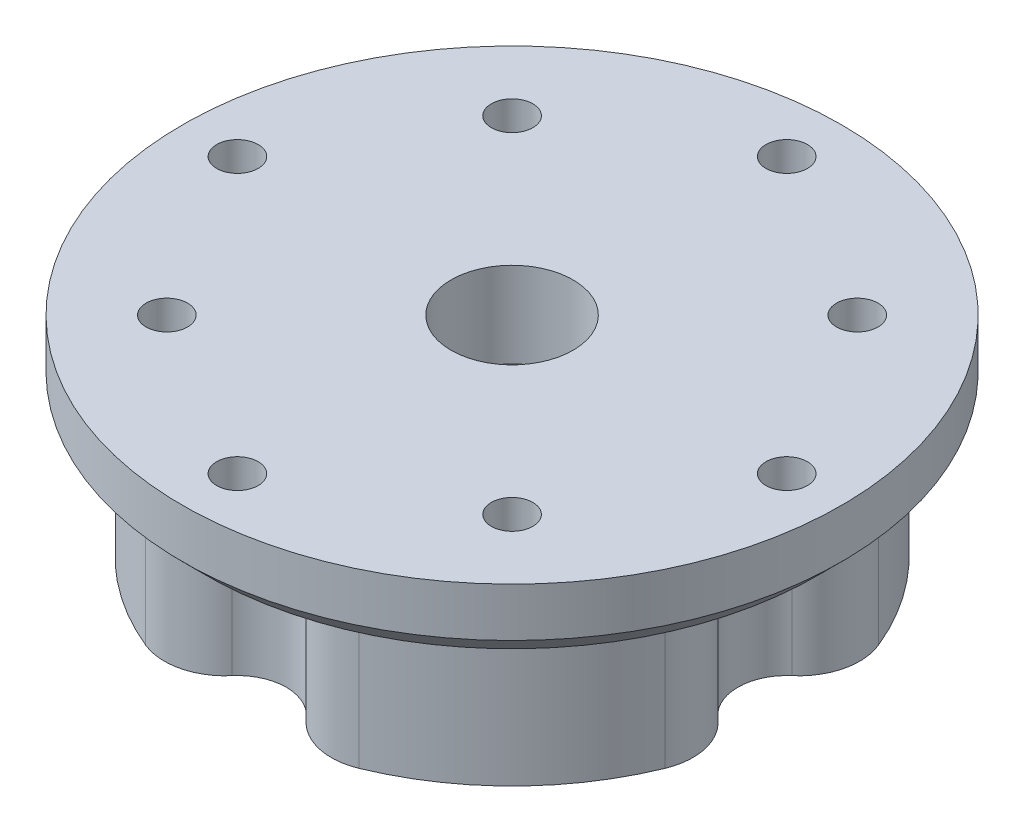
from build123d import *

# Parameters (mm, degrees)
M3_CLEARANCE_HOLE1_D           = 3.4
CUT_EXTRUDE1_DEPTH             = 11.156
FILLET1_R                      = 5
CIRPATTERN1_COUNT              = 4
FILLET1_OF_CIRPATTERN1_R       = 5
CBORE_FOR_M5_SHCS1_D           = 5.5
CBORE_FOR_M5_SHCS1_CBORE_D     = 10
CBORE_FOR_M5_SHCS1_CBORE_DEPTH = 7
CHAMFER1_SIZE                  = 0.75
CHAMFER2_SIZE                  = 2


with BuildPart() as part:
    # Sketch1 → Revolve1 (revolve)
    with BuildSketch(Plane.XY, mode=Mode.PRIVATE) as revolve1_sk:
        Polygon((6.8, 0), (6.8, 4.953), (0, 4.953), (0, 17.156), (27, 17.156), (27, 11.156), (23, 11.156), (23, 0), align=None)
    revolve(revolve1_sk.sketch.rotate(Axis((0, 0, 0), (0, 1, 0)), 90), axis=Axis((0, 0, 0), (0, 1, 0)))

    # M3 Clearance Hole1 (through all)
    with Locations(Plane.XZ):
        with Locations((-14.142135624, -14.142135624), (-22.5, 0)):
            m3_clearance_hole1 = Hole(M3_CLEARANCE_HOLE1_D / 2)

    # Sketch5 → Cut-Extrude1 (cut)
    with BuildSketch(Plane.XZ):
        with BuildLine():
            ThreePointArc((-22.65, -3.997186511), (-18.5, 0), (-22.65, 3.997186511))
            ThreePointArc((-22.65, 3.997186511), (-23, 0), (-22.65, -3.997186511))
        make_face()
    cut_extrude1 = extrude(amount=-CUT_EXTRUDE1_DEPTH, mode=Mode.SUBTRACT)

    # Fillet1
    fillet1_edges = [part.edges().sort_by_distance(p)[0] for p in [
        (-22.65, 5.578, -3.997186511),
        (-22.65, 5.578, 3.997186511),
    ]]
    fillet(fillet1_edges, radius=FILLET1_R)

    # CirPattern1: M3 Clearance Hole1, Cut-Extrude1 ×4 about axis
    cirpattern1_axis = Axis((0, 0, 0), (0, 1, 0))
    add([m3_clearance_hole1.rotate(cirpattern1_axis, i * 360 / CIRPATTERN1_COUNT) for i in range(1, CIRPATTERN1_COUNT)], mode=Mode.SUBTRACT)
    add([cut_extrude1.rotate(cirpattern1_axis, i * 360 / CIRPATTERN1_COUNT) for i in range(1, CIRPATTERN1_COUNT)], mode=Mode.SUBTRACT)

    # Fillet1 of CirPattern1
    fillet1_of_cirpattern1_edges = [part.edges().sort_by_distance(p)[0] for p in [
        (-3.997186511, 5.578, 22.65),
        (3.997186511, 5.578, 22.65),
        (22.65, 5.578, 3.997186511),
        (22.65, 5.578, -3.997186511),
        (3.997186511, 5.578, -22.65),
        (-3.997186511, 5.578, -22.65),
    ]]
    fillet(fillet1_of_cirpattern1_edges, radius=FILLET1_OF_CIRPATTERN1_R)

    # CBORE for M5 SHCS1 (through all)
    with Locations(Plane(origin=(0, 17.156, 0), x_dir=(1, 0, 0), z_dir=(0, 1, 0))):
        with Locations((0, 0)):
            CounterBoreHole(CBORE_FOR_M5_SHCS1_D / 2, CBORE_FOR_M5_SHCS1_CBORE_D / 2, CBORE_FOR_M5_SHCS1_CBORE_DEPTH)

    # Chamfer1
    chamfer1_edges = [part.edges().sort_by_distance(p)[0] for p in [
        (0, 0, 6.8),
    ]]
    chamfer(chamfer1_edges, length=CHAMFER1_SIZE)

    # Chamfer2
    chamfer2_edges = [part.edges().sort_by_distance(p)[0] for p in [
        (0, 11.156, 27),
    ]]
    chamfer(chamfer2_edges, length=CHAMFER2_SIZE)


solid = part.part
